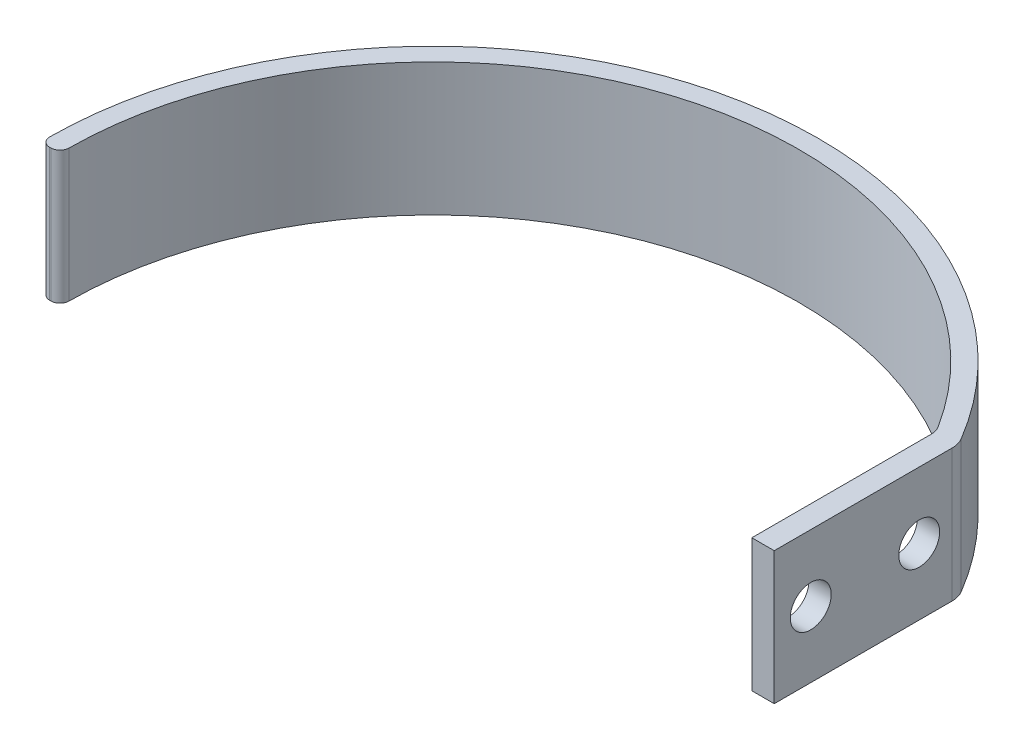
from build123d import *

# Parameters (mm, degrees)
BOSS_EXTRUDE1_DEPTH       = 11
SKETCH2_W                 = 6.051968164
SKETCH2_H                 = 15.31
BOSS_EXTRUDE2_DEPTH       = 11
FILLET2_R                 = 1.5
FILLET4_R                 = 0.75
CUT_EXTRUDE4_REACH        = 48.572
SKETCH5_W                 = 4.194556819
SKETCH5_H                 = 15.31
FILLET6_R                 = 2
M3_CLEARANCE_HOLE1_REACH  = 70.71
M3_CLEARANCE_HOLE1_BORE_R = 1.7


with BuildPart() as part:
    # Sketch1 → Boss-Extrude1 (new body)
    with BuildSketch(Plane(origin=(0, 0, 0), x_dir=(1, 0, 0), z_dir=(0, 1, 0))):
        with BuildLine():
            Line((-31.995504557, -0.536365667), (-30.395504557, -0.536365667))
            ThreePointArc((-30.395504557, -0.536365667), (-0.536365667, 30.395504557), (30.395504557, 0.536365667))
            Line((30.395504557, 0.536365667), (31.995504557, 0.536365667))
            ThreePointArc((31.995504557, 0.536365667), (-0.536365667, 31.995504557), (-31.995504557, -0.536365667))
        make_face()
    extrude(amount=BOSS_EXTRUDE1_DEPTH)

    # Sketch2 → Boss-Extrude2 (add, through all)
    with BuildSketch(Plane(origin=(0, 11, 0), x_dir=(1, 0, 0), z_dir=(0, 1, 0))):
        with Locations((28.969520475, 8.191365667)):
            Rectangle(SKETCH2_W, SKETCH2_H)
    extrude(amount=-BOSS_EXTRUDE2_DEPTH)

    # Fillet2
    fillet2_edges = [part.edges().sort_by_distance(p)[0] for p in [
        (25.943536393, 5.5, -15.846365667),
    ]]
    fillet(fillet2_edges, radius=FILLET2_R)

    # Fillet4
    fillet4_edges = [part.edges().sort_by_distance(p)[0] for p in [
        (-31.995504557, 5.5, 0.536365667),
        (-30.395504557, 5.5, 0.536365667),
    ]]
    fillet(fillet4_edges, radius=FILLET4_R)

    # Sketch5 → Cut-Extrude4 (cut, up to next)
    with BuildSketch(Plane(origin=(0, 11, 0), x_dir=(1, 0, 0), z_dir=(0, 1, 0)), mode=Mode.PRIVATE) as cut_extrude4_sk1:
        with Locations((29.898226148, 8.191365667)):
            Rectangle(SKETCH5_W, SKETCH5_H)
    cut_extrude4_tool1 = extrude(cut_extrude4_sk1.sketch, amount=-CUT_EXTRUDE4_REACH, mode=Mode.PRIVATE) & part.part
    add(cut_extrude4_tool1.solids().sort_by_distance((29.898226, 11, -8.191366))[0], mode=Mode.SUBTRACT)

    # Fillet6
    fillet6_edges = [part.edges().sort_by_distance(p)[0] for p in [
        (27.800947738, 5.5, -15.846365667),
    ]]
    fillet(fillet6_edges, radius=FILLET6_R)

    # M3 Clearance Hole1 bore → M3 Clearance Hole1 (cut, up to next)
    with BuildSketch(Plane(origin=(27.800947738, 0, 0), x_dir=(0, 0, -1), z_dir=(1, 0, 0)), mode=Mode.PRIVATE) as m3_clearance_hole1_sk1:
        with Locations((12.566365667, 5.5)):
            Circle(M3_CLEARANCE_HOLE1_BORE_R)
    m3_clearance_hole1_tool1 = extrude(m3_clearance_hole1_sk1.sketch, amount=-M3_CLEARANCE_HOLE1_REACH, mode=Mode.PRIVATE) & part.part
    # M3 Clearance Hole1 bore → M3 Clearance Hole1 (cut, up to next)
    with BuildSketch(Plane(origin=(27.800947738, 0, 0), x_dir=(0, 0, -1), z_dir=(1, 0, 0)), mode=Mode.PRIVATE) as m3_clearance_hole1_sk2:
        with Locations((3.566365667, 5.5)):
            Circle(M3_CLEARANCE_HOLE1_BORE_R)
    m3_clearance_hole1_tool2 = extrude(m3_clearance_hole1_sk2.sketch, amount=-M3_CLEARANCE_HOLE1_REACH, mode=Mode.PRIVATE) & part.part
    add(m3_clearance_hole1_tool1.solids().sort_by_distance((27.800948, 5.5, -12.566366))[0], mode=Mode.SUBTRACT)
    add(m3_clearance_hole1_tool2.solids().sort_by_distance((27.800948, 5.5, -3.566366))[0], mode=Mode.SUBTRACT)


solid = part.part
